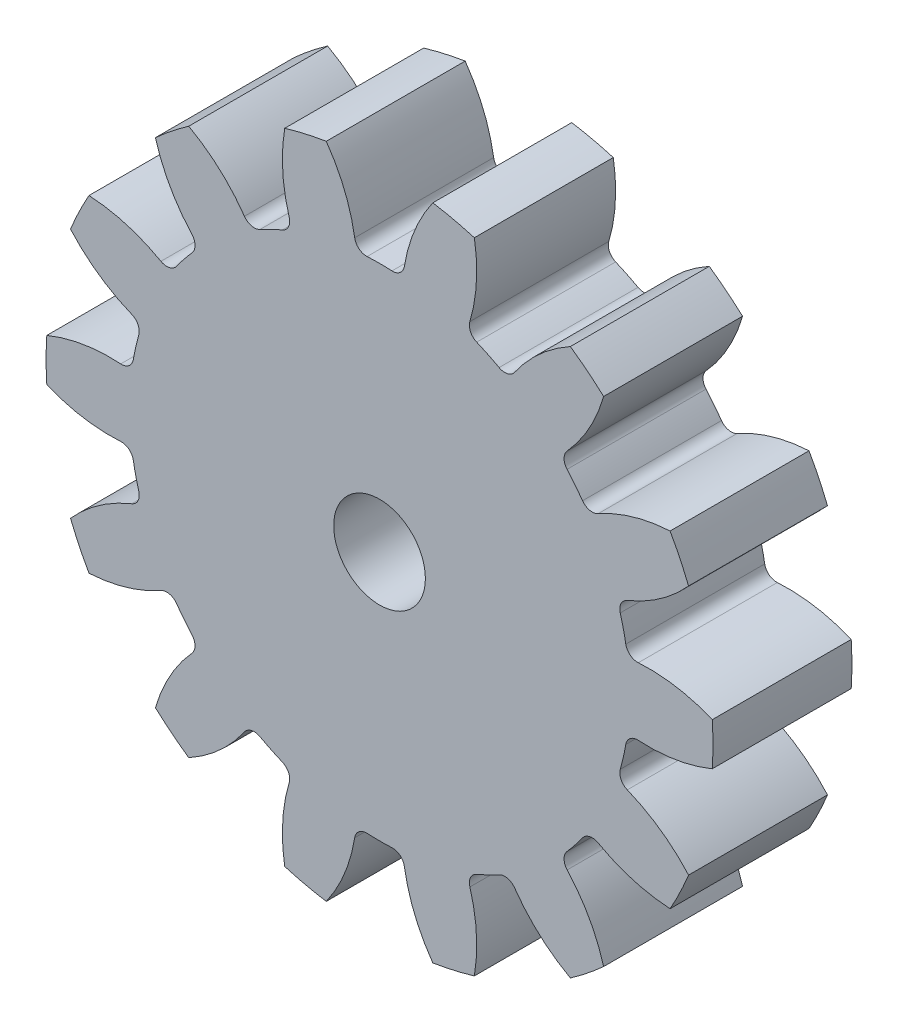
from build123d import *

# Parameters (mm, degrees)
SKETCH1_R                      = 12
BOSS_EXTRUDE1_DEPTH            = 2.5
CUT_EXTRUDE1_DEPTH             = 18.153716798
FILLET2_R                      = 0.43
CIRPATTERN1_COUNT              = 14
FILLET2_OF_CIRPATTERN1_R       = 0.43
THROUGH_CENTER_HOLE_DEPTH      = 18.046206741
THROUGH_CENTER_HOLE_DEPTH_BACK = 18.046206741
SKETCH4_R                      = 1.65


with BuildPart() as part:
    # Sketch1 → Boss-Extrude1 (new, symmetric)
    with BuildSketch(Plane.XY):
        Circle(SKETCH1_R)
    extrude(amount=BOSS_EXTRUDE1_DEPTH, both=True)

    # Sketch3 → Cut-Extrude1 (cut, symmetric)
    with BuildSketch(Plane.XY):
        with BuildLine():
            ThreePointArc((1.917509067, 11.845807654), (1.190322396, 10.473907615), (0.843805856, 8.960356671))
            ThreePointArc((0.843805856, 8.960356671), (0, 9), (-0.843805856, 8.960356671))
            ThreePointArc((-0.843805856, 8.960356671), (-1.190322396, 10.473907615), (-1.917509067, 11.845807654))
            ThreePointArc((-1.917509067, 11.845807654), (0, 12), (1.917509067, 11.845807654))
        make_face()
    cut_extrude1 = extrude(amount=CUT_EXTRUDE1_DEPTH, both=True, mode=Mode.SUBTRACT)

    # Fillet2
    fillet2_edges = [part.edges().sort_by_distance(p)[0] for p in [
        (-0.843805856, 8.960356671, 0),
        (0.843805856, 8.960356671, 0),
    ]]
    fillet(fillet2_edges, radius=FILLET2_R)

    # CirPattern1: Cut-Extrude1 ×14 about axis
    cirpattern1_axis = Axis((0, 0, 0), (0, 0, 1))
    for i in range(1, CIRPATTERN1_COUNT):
        add(cut_extrude1.rotate(cirpattern1_axis, i * 360 / CIRPATTERN1_COUNT), mode=Mode.SUBTRACT)

    # Fillet2 of CirPattern1
    fillet2_of_cirpattern1_edges = [part.edges().sort_by_distance(p)[0] for p in [
        (-4.647995863, 7.706888766, 0),
        (-3.12751025, 8.439116046, 0),
        (-7.531593286, 4.926977022, 0),
        (-6.479384594, 6.246404989, 0),
        (-8.923466289, 1.171217054, 0),
        (-8.547937355, 2.816516817, 0),
        (-8.547937355, -2.816516817, 0),
        (-8.923466289, -1.171217054, 0),
        (-6.479384594, -6.246404989, 0),
        (-7.531593286, -4.926977022, 0),
        (-3.12751025, -8.439116046, 0),
        (-4.647995863, -7.706888766, 0),
        (0.843805856, -8.960356671, 0),
        (-0.843805856, -8.960356671, 0),
        (4.647995863, -7.706888766, 0),
        (3.12751025, -8.439116046, 0),
        (7.531593286, -4.926977022, 0),
        (6.479384594, -6.246404989, 0),
        (8.923466289, -1.171217054, 0),
        (8.547937355, -2.816516817, 0),
        (8.547937355, 2.816516817, 0),
        (8.923466289, 1.171217054, 0),
        (6.479384594, 6.246404989, 0),
        (7.531593286, 4.926977022, 0),
        (3.12751025, 8.439116046, 0),
        (4.647995863, 7.706888766, 0),
    ]]
    fillet(fillet2_of_cirpattern1_edges, radius=FILLET2_OF_CIRPATTERN1_R)

    # Sketch4 → Through_Center_Hole (cut, two sides: drawn at the far end of the back side and taken through both)
    with BuildSketch(Plane.XY.offset(-THROUGH_CENTER_HOLE_DEPTH_BACK)):
        Circle(SKETCH4_R)
    extrude(amount=THROUGH_CENTER_HOLE_DEPTH + THROUGH_CENTER_HOLE_DEPTH_BACK, mode=Mode.SUBTRACT)


solid = part.part
